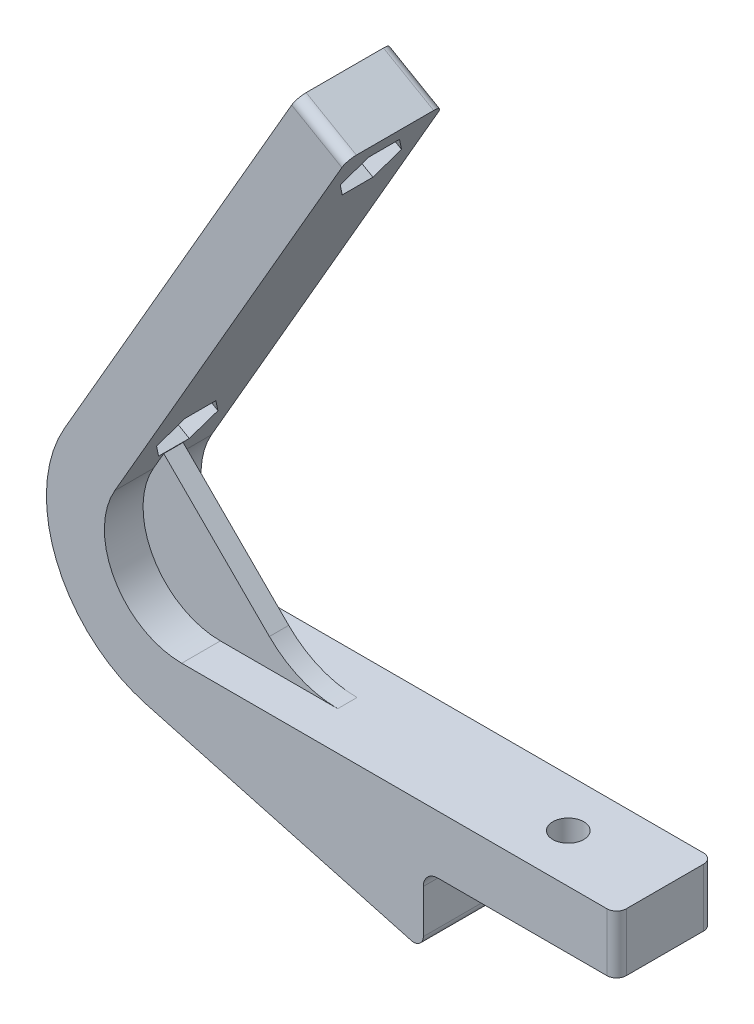
from build123d import *

# Parameters (mm, degrees)
EXTRUDE_1_DEPTH     = 5
SKETCH_2_R          = 1.6
CUT_EXTRUDE_1_DEPTH = 76.007176866
SKETCH_3_R          = 1.6
CUT_EXTRUDE_2_DEPTH = 6
CUT_EXTRUDE_3_DEPTH = 2
FILLET_1_R          = 1
EXTRUDE_2_DEPTH     = 1
FILLET_2_R          = 1.5
FILLET_3_R          = 10


with BuildPart() as part:
    # 草图1 → 凸台-拉伸1 (new, symmetric)
    with BuildSketch(Plane.XY):
        with BuildLine():
            Line((-41.92820323, 12), (-17.92820323, 53.569219382))
            Line((-17.92820323, 53.569219382), (-23.124355653, 56.569219382))
            Line((-23.124355653, 56.569219382), (-47.124355653, 15))
            ThreePointArc((-47.124355653, 15), (-47.94437584, 2.666789511), (-38.674353195, -5.509223834))
            Line((-38.674353195, -5.509223834), (-11.2624538, -12.96494456))
            ThreePointArc((-11.2624538, -12.96494456), (-10.39273309, -12.794497892), (-10, -12))
            Line((-10, -12), (-10, -6))
            Line((-10, -6), (10, -6))
            Line((10, -6), (10, 0))
            Line((10, 0), (-35, 0))
            ThreePointArc((-35, 0), (-41.92820323, 4), (-41.92820323, 12))
        make_face()
    extrude(amount=EXTRUDE_1_DEPTH, both=True)

    # 草图2 → 切除-拉伸1 (cut, through all)
    with BuildSketch(Plane(origin=(0, 0, 0), x_dir=(1, 0, 0), z_dir=(0, 1, 0))):
        with Locations(Location((0, 0, 0), (0, 0, 180))):
            Circle(SKETCH_2_R)
    extrude(amount=-CUT_EXTRUDE_1_DEPTH, mode=Mode.SUBTRACT)

    # 草图3 → 切除-拉伸2 (cut)
    with BuildSketch(Plane(origin=(-41.838457268, 24.155444566, 0), x_dir=(0, 0, 1), z_dir=(-0.8660254037844367, 0.5000000000000036, 0))):
        with Locations(Location((0, 32.42820323, 0), (0, 0, 270))):
            Circle(SKETCH_3_R)
        with Locations(Location((0, -5.57179677, 0), (0, 0, 270))):
            Circle(SKETCH_3_R)
    extrude(amount=-CUT_EXTRUDE_2_DEPTH, mode=Mode.SUBTRACT)

    # 草图4 → 切除-拉伸3 (cut)
    with BuildSketch(Plane(origin=(-36.642304845, 21.155444566, 0), x_dir=(0, 0, -1), z_dir=(0.8660254037844365, -0.5000000000000039, 0))):
        Polygon((1.58771324, 35.17820323), (-1.58771324, 35.17820323), (-3.175426481, 32.42820323), (-1.58771324, 29.67820323), (1.58771324, 29.67820323), (3.175426481, 32.42820323), align=None)
        Polygon((1.58771324, -2.82179677), (-1.58771324, -2.82179677), (-3.175426481, -5.57179677), (-1.58771324, -8.32179677), (1.58771324, -8.32179677), (3.175426481, -5.57179677), align=None)
    extrude(amount=-CUT_EXTRUDE_3_DEPTH, mode=Mode.SUBTRACT)

    # 圆角1
    fillet_1_edges = [part.edges().sort_by_distance(p)[0] for p in [
        (10, -3, -5),
        (-20.526279442, 55.069219382, -5),
        (-20.526279442, 55.069219382, 5),
        (10, -3, 5),
    ]]
    fillet(fillet_1_edges, radius=FILLET_1_R)

    # 草图6 → 凸台-拉伸2 (add, symmetric)
    with BuildSketch(Plane.XY):
        with BuildLine():
            Line((-41.92820323, 12), (-40.856406461, 13.856406461))
            Line((-40.856406461, 13.856406461), (-27, 0))
            Line((-27, 0), (-35, 0))
            ThreePointArc((-35, 0), (-41.92820323, 4), (-41.92820323, 12))
        make_face()
    extrude(amount=EXTRUDE_2_DEPTH, both=True)

    # 圆角2
    fillet_2_edges = [part.edges().sort_by_distance(p)[0] for p in [
        (-10, -6, 0),
    ]]
    fillet(fillet_2_edges, radius=FILLET_2_R)

    # 圆角3
    fillet_3_edges = [part.edges().sort_by_distance(p)[0] for p in [
        (-27, 0, 0),
    ]]
    fillet(fillet_3_edges, radius=FILLET_3_R)


solid = part.part
